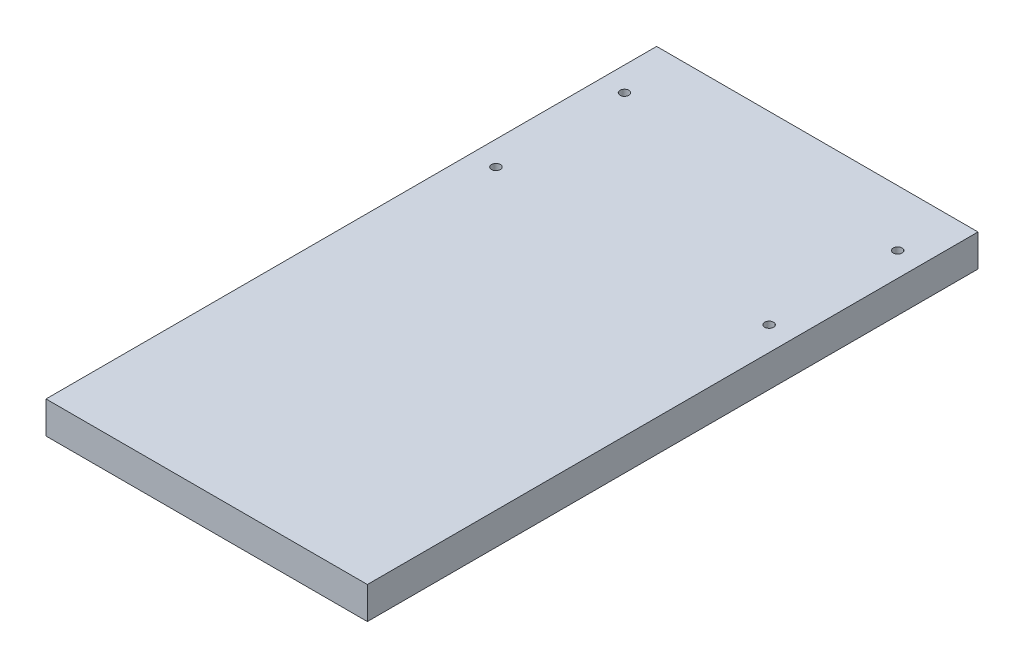
from build123d import *

# Parameters (mm, degrees)
SKETCH1_W           = 100
SKETCH1_H           = 190
BOSS_EXTRUDE1_DEPTH = 10
SKETCH2_R           = 1.375
CUT_EXTRUDE1_DEPTH  = 7


with BuildPart() as part:
    # Sketch1 → Boss-Extrude1 (new body)
    with BuildSketch(Plane(origin=(0, 0, 0), x_dir=(1, 0, 0), z_dir=(0, 1, 0))):
        Rectangle(SKETCH1_W, SKETCH1_H)
    extrude(amount=BOSS_EXTRUDE1_DEPTH)

    # Sketch2 → Cut-Extrude1 (cut)
    with BuildSketch(Plane(origin=(0, 10, 0), x_dir=(1, 0, 0), z_dir=(0, 1, 0))):
        with Locations(Location((-42.5, 77.5, 0), (0, 0, 270))):
            Circle(SKETCH2_R)
        with Locations(Location((-42.5, 37.5, 0), (0, 0, 270))):
            Circle(SKETCH2_R)
        with Locations(Location((42.5, 37.5, 0), (0, 0, 90))):
            Circle(SKETCH2_R)
        with Locations(Location((42.5, 77.5, 0), (0, 0, 90))):
            Circle(SKETCH2_R)
    extrude(amount=-CUT_EXTRUDE1_DEPTH, mode=Mode.SUBTRACT)


solid = part.part
